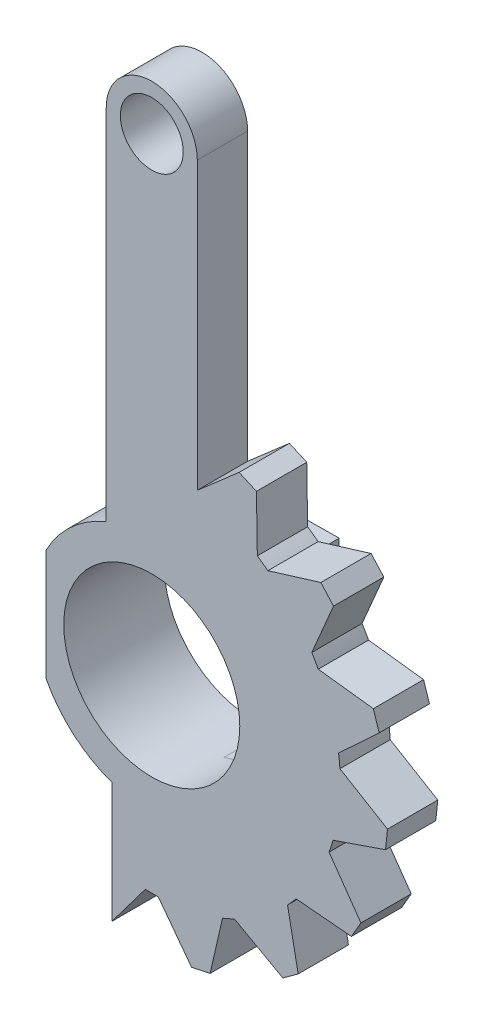
from build123d import *

# Parameters (mm, degrees)
SKETCH1_R           = 3.5
SKETCH1_R_2         = 1.25
BOSS_EXTRUDE2_DEPTH = 2
BOSS_EXTRUDE3_START = -2
BOSS_EXTRUDE3_DEPTH = 3.5


with BuildPart() as part:
    # Sketch1 → Boss-Extrude2 (new body)
    with BuildSketch(Plane.XY):
        with BuildLine():
            Line((4.197420544, 6.215437295), (4.162047902, 8.420458768))
            Line((4.162047902, 8.420458768), (3.472666725, 8.727391043))
            Line((3.472666725, 8.727391043), (1.81034751, 7.278230684))
            Line((1.81034751, 7.278230684), (1.81034751, 18.65))
            ThreePointArc((1.81034751, 18.65), (0, 20.46034751), (-1.81034751, 18.65))
            Line((-1.81034751, 18.65), (-1.81034751, 4.391485158))
            ThreePointArc((-1.81034751, 4.391485158), (-3.193479033, 3.516275255), (-4.197420544, 2.22354689))
            Line((-4.197420544, 2.22354689), (-4.197420544, -2.22354689))
            ThreePointArc((-4.197420544, -2.22354689), (-3.102034148, -3.597205046), (-1.582253997, -4.478724404))
            Line((-1.582253997, -4.478724404), (-1.582253997, -9.258684619))
            Line((-1.582253997, -9.258684619), (-0.257557826, -7.495576293))
            ThreePointArc((-0.257557826, -7.495576293), (0, -7.5), (0.257557826, -7.495576293))
            Line((0.257557826, -7.495576293), (1.582253997, -9.258684619))
            Line((1.582253997, -9.258684619), (2.32038535, -9.101789957))
            Line((2.32038535, -9.101789957), (2.813434757, -6.952307881))
            ThreePointArc((2.813434757, -6.952307881), (3.050524823, -6.851590932), (3.284016321, -6.74279147))
            Line((3.284016321, -6.74279147), (5.211307253, -7.814668599))
            Line((5.211307253, -7.814668599), (5.821808989, -7.371113124))
            Line((5.821808989, -7.371113124), (5.397958912, -5.206922276))
            ThreePointArc((5.397958912, -5.206922276), (5.573586191, -5.018479548), (5.74263856, -4.824116744))
            Line((5.74263856, -4.824116744), (7.939278142, -5.019425383))
            Line((7.939278142, -5.019425383), (8.316588965, -4.365903867))
            Line((8.316588965, -4.365903867), (7.049126932, -2.561212506))
            ThreePointArc((7.049126932, -2.561212506), (7.132923872, -2.317627458), (7.208306422, -2.071308409))
            Line((7.208306422, -2.071308409), (9.294475714, -1.356277919))
            Line((9.294475714, -1.356277919), (9.373355155, -0.605790169))
            Line((9.373355155, -0.605790169), (7.481436866, 0.527354174))
            ThreePointArc((7.481436866, 0.527354174), (7.458914215, 0.783963475), (7.427592618, 1.039647968))
            Line((7.427592618, 1.039647968), (9.042573998, 2.541382319))
            Line((9.042573998, 2.541382319), (8.809383085, 3.259070153))
            Line((8.809383085, 3.259070153), (6.620138399, 3.524736526))
            ThreePointArc((6.620138399, 3.524736526), (6.495190528, 3.75), (6.362580573, 3.970839767))
            Line((6.362580573, 3.970839767), (7.227129088, 5.999614466))
            Line((7.227129088, 5.999614466), (6.722188648, 6.560407638))
            Line((6.722188648, 6.560407638), (4.614157861, 5.912659912))
            ThreePointArc((4.614157861, 5.912659912), (4.408389392, 6.067627458), (4.197420544, 6.215437295))
        make_face()
        Circle(SKETCH1_R, mode=Mode.SUBTRACT)
        with Locations((0, 18.65)):
            Circle(SKETCH1_R_2, mode=Mode.SUBTRACT)
    extrude(amount=BOSS_EXTRUDE2_DEPTH)

    # Sketch1<4> → Boss-Extrude3 (add)
    with BuildSketch(Plane.XY.offset(BOSS_EXTRUDE3_START)):
        with BuildLine():
            Line((3.454592444, 4.453459903), (-1.81034751, 4.391485158))
            ThreePointArc((-1.81034751, 4.391485158), (-3.193479033, 3.516275255), (-4.197420544, 2.22354689))
            Line((-4.197420544, 2.22354689), (-4.197420544, -2.22354689))
            ThreePointArc((-4.197420544, -2.22354689), (-3.193479033, -3.516275255), (-1.81034751, -4.391485158))
            Line((-1.81034751, -4.391485158), (3.454592444, -4.453459903))
            Line((3.454592444, -4.453459903), (3.339363392, -2.757369614))
            Line((3.339363392, -2.757369614), (0.868808697, -3.390452986))
            ThreePointArc((0.868808697, -3.390452986), (-3.5, 0), (0.868808697, 3.390452986))
            Line((0.868808697, 3.390452986), (0.896736855, 3.383296353))
            Line((0.896736855, 3.383296353), (3.339363392, 2.757369614))
            Line((3.339363392, 2.757369614), (3.454592444, 4.453459903))
        make_face()
    extrude(amount=BOSS_EXTRUDE3_DEPTH)


solid = part.part
